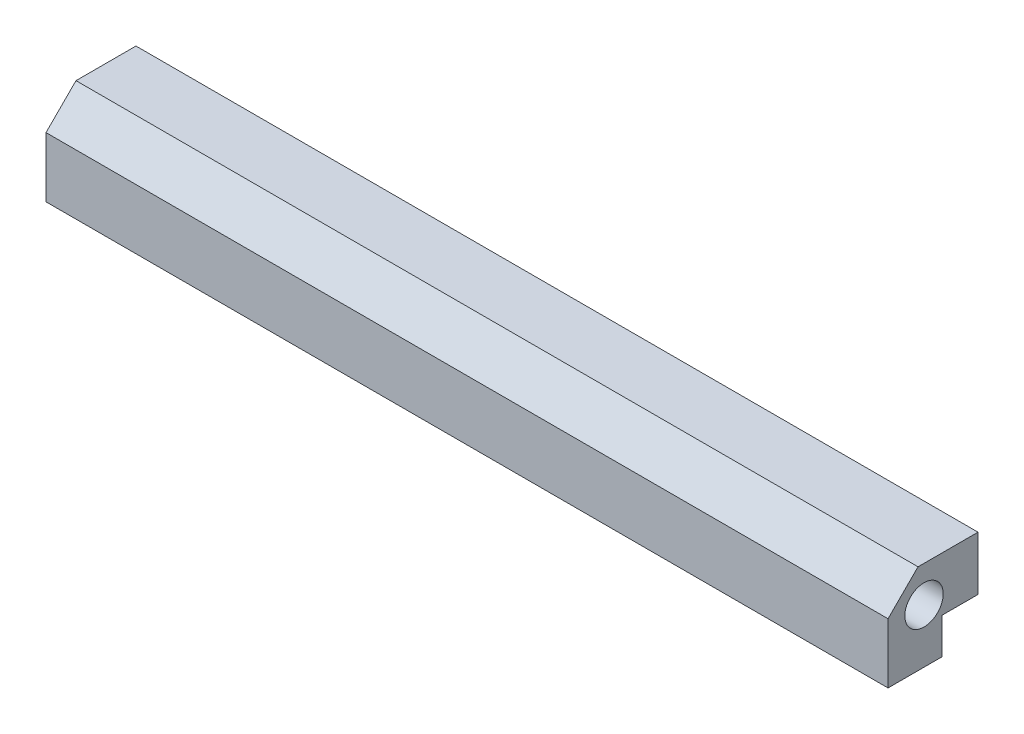
from build123d import *

# Parameters (mm, degrees)
ESQUISSE3_R             = 2.35
BOSS_EXTRU_2_DEPTH      = 70.2
CHANFREIN1_SIZE         = 5
ESQUISSE6_R             = 3.2
ESQUISSE6_R_2           = 2.35
ENL_V_MAT_EXTRU_1_DEPTH = 7
ENL_V_START             = -7
ESQUISSE7_R             = 3.2
ESQUISSE7_R_2           = 2.35
ENL_V_MAT_EXTRU_2_DEPTH = 7


with BuildPart() as part:
    # Esquisse3 → Boss.-Extru.2 (new, symmetric)
    with BuildSketch(Plane(origin=(0, 0, 0), x_dir=(0, 0, -1), z_dir=(1, 0, 0))):
        Polygon((-4.5, -10.5), (-4.5, 4.5), (10.5, 4.5), (10.5, -4.5), (4.5, -4.5), (4.5, -10.5), align=None)
        with Locations((1.5, -1.5)):
            Circle(ESQUISSE3_R, mode=Mode.SUBTRACT)
    extrude(amount=BOSS_EXTRU_2_DEPTH, both=True)

    # Chanfrein1
    chanfrein1_edges = [part.edges().sort_by_distance(p)[0] for p in [
        (0, 4.5, 4.5),
    ]]
    chamfer(chanfrein1_edges, length=CHANFREIN1_SIZE)

    # Esquisse6 → Enlèv. mat.-Extru.1 (cut)
    with BuildSketch(Plane.ZY.offset(70.2)):
        with Locations((-1.5, -1.5)):
            Circle(ESQUISSE6_R)
        with Locations((-1.5, -1.5)):
            Circle(ESQUISSE6_R_2, mode=Mode.SUBTRACT)
    extrude(amount=-ENL_V_MAT_EXTRU_1_DEPTH, mode=Mode.SUBTRACT)

    # Esquisse7 → Enlèv. mat.-Extru.2 (cut)
    with BuildSketch(Plane(origin=(70.2, 0, 0), x_dir=(0, 0, -1), z_dir=(1, 0, 0)).offset(ENL_V_START)):
        with Locations(Location((1.5, -1.5, 0), (0, 0, 180))):
            Circle(ESQUISSE7_R)
        with Locations(Location((1.5, -1.5, 0), (0, 0, 180))):
            Circle(ESQUISSE7_R_2, mode=Mode.SUBTRACT)
    extrude(amount=ENL_V_MAT_EXTRU_2_DEPTH, mode=Mode.SUBTRACT)


solid = part.part
